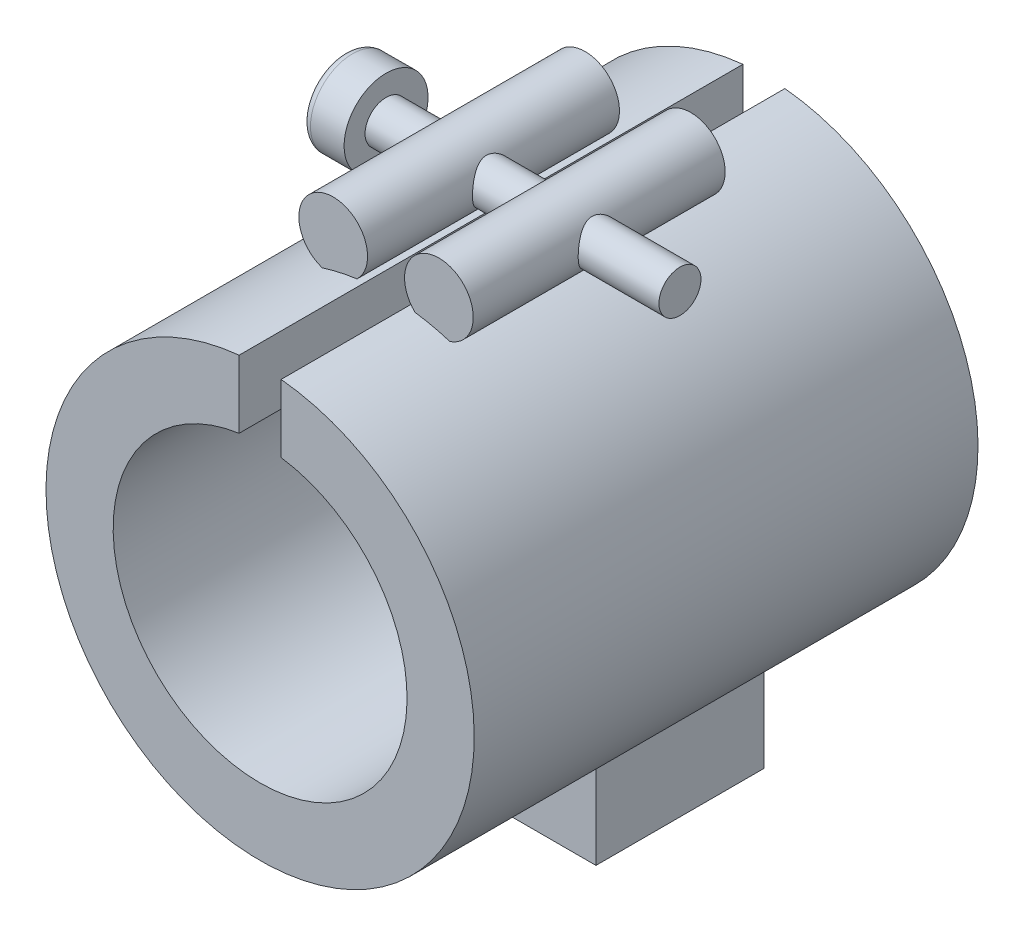
from build123d import *

# Parameters (mm, degrees)
BOSS_EXTRUDE1_DEPTH      = 30
SKETCH2_R                = 4.091242679
BOSS_EXTRUDE2_DEPTH      = 15
SKETCH3_W                = 20
SKETCH3_H                = 12.982921918
BOSS_EXTRUDE3_DEPTH      = 20
BOSS_EXTRUDE5_DEPTH      = 20
BOSS_EXTRUDE5_DEPTH_BACK = 20
SKETCH5_R                = 2.5
SKETCH6_R                = 5
BOSS_EXTRUDE6_DEPTH      = 5
CUT_EXTRUDE1_DEPTH       = 3
FILLET2_R                = 1


with BuildPart() as part:
    # Sketch1 → Boss-Extrude1 (new, symmetric)
    with BuildSketch(Plane.XY):
        with BuildLine():
            Line((-2.5, 25.377155081), (-2.5, 17.320508076))
            ThreePointArc((-2.5, 17.320508076), (0, -17.5), (2.5, 17.320508076))
            Line((2.5, 17.320508076), (2.5, 25.377155081))
            ThreePointArc((2.5, 25.377155081), (0, -25.5), (-2.5, 25.377155081))
        make_face()
    extrude(amount=BOSS_EXTRUDE1_DEPTH, both=True)

    # Sketch2 → Boss-Extrude2 (add, symmetric)
    with BuildSketch(Plane.XY):
        with Locations((6.293533022, 28.211487403)):
            Circle(SKETCH2_R)
        with Locations((-6.293533022, 28.211487403)):
            Circle(SKETCH2_R)
    extrude(amount=BOSS_EXTRUDE2_DEPTH, both=True)

    # Sketch3 → Boss-Extrude3 (add)
    with BuildSketch(Plane.XY):
        with Locations((0, -29.508539041)):
            Rectangle(SKETCH3_W, SKETCH3_H)
    extrude(amount=-BOSS_EXTRUDE3_DEPTH)

    # Sketch5 → Boss-Extrude5 (add, two sides: drawn at the far end of the back side and taken through both)
    with BuildSketch(Plane(origin=(0, 0, 0), x_dir=(0, 0, -1), z_dir=(1, 0, 0)).offset(-BOSS_EXTRUDE5_DEPTH_BACK)):
        with Locations((0, 28.211487403)):
            Circle(SKETCH5_R)
    extrude(amount=BOSS_EXTRUDE5_DEPTH + BOSS_EXTRUDE5_DEPTH_BACK)

    # Sketch6 → Boss-Extrude6 (add)
    with BuildSketch(Plane.ZY.offset(20)):
        with Locations((0, 28.211487403)):
            Circle(SKETCH6_R)
    extrude(amount=-BOSS_EXTRUDE6_DEPTH)

    # Sketch7 → Cut-Extrude1 (cut)
    with BuildSketch(Plane.ZY.offset(20)):
        Polygon((1.58771324, 25.461487403), (3.175426481, 28.211487403), (1.58771324, 30.961487403), (-1.58771324, 30.961487403), (-3.175426481, 28.211487403), (-1.58771324, 25.461487403), align=None)
    extrude(amount=-CUT_EXTRUDE1_DEPTH, mode=Mode.SUBTRACT)

    # Fillet2
    fillet2_edges = [part.edges().sort_by_distance(p)[0] for p in [
        (-20, 28.211487403, -5),
    ]]
    fillet(fillet2_edges, radius=FILLET2_R)


solid = part.part
